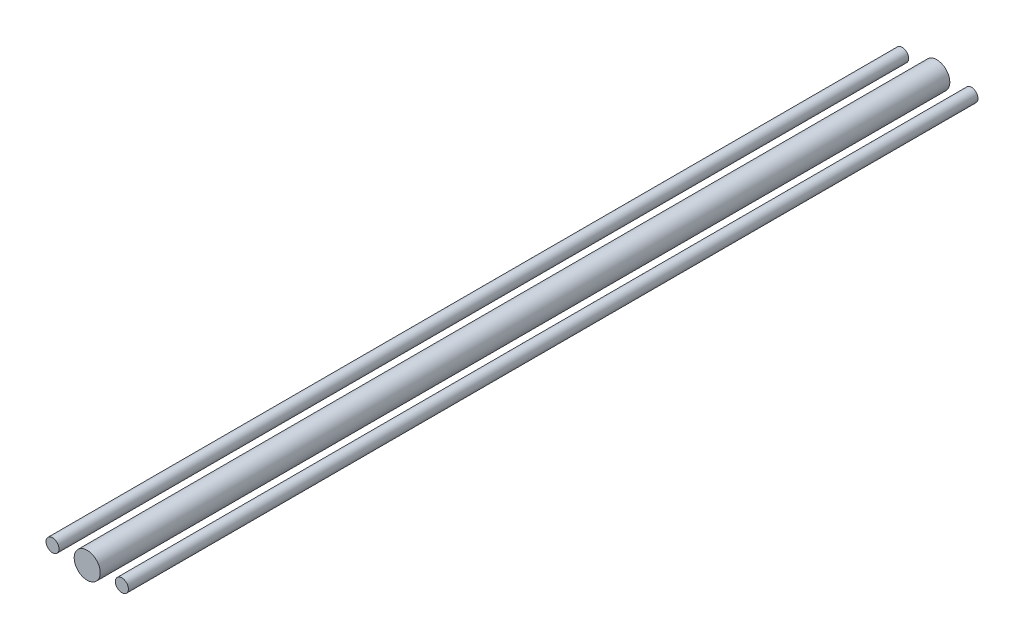
from build123d import *

# Parameters (mm, degrees)
SKETCH_1_R               = 15
EXTRUDE_1_DEPTH          = 1000
SKETCH_6_R               = 7.5
EXTRUDE_2_DEPTH          = 1000
EXTRUDE_2_2_DEPTH        = 1000
CUT_EXTRUDE_1_DEPTH      = 1006.547725945
CUT_EXTRUDE_1_DEPTH_BACK = 1006.547725945
SKETCH_7_W               = 43.373576948
SKETCH_7_H               = 87.109491317


with BuildPart() as part:
    # 草图1 → 凸台-拉伸1 (new body)
    with BuildSketch(Plane.XY):
        Circle(SKETCH_1_R)
    extrude(amount=EXTRUDE_1_DEPTH)


with BuildPart() as body_2:
    # 草图6 → 凸台-拉伸2 (new body)
    with BuildSketch(Plane(origin=(0, 0, 0), x_dir=(-1, 0, 0), z_dir=(0, 0, -1))):
        with Locations((-40, 0)):
            Circle(SKETCH_6_R)
    extrude(amount=-EXTRUDE_2_DEPTH)


with BuildPart() as body_3:
    # 草图6 → Extrude 2 2 (new body)
    with BuildSketch(Plane(origin=(0, 0, 0), x_dir=(-1, 0, 0), z_dir=(0, 0, -1))):
        with Locations((40, 0)):
            Circle(SKETCH_6_R)
    extrude(amount=-EXTRUDE_2_2_DEPTH)


with BuildPart() as cut_extrude_1_tool:
    # 草图7 → 切除-拉伸1 (new, two sides: drawn at the far end of the back side and taken through both)
    with BuildSketch(Plane.ZY.offset(56.908951495).offset(-CUT_EXTRUDE_1_DEPTH_BACK)):
        with Locations((-1.686788474, -10.270563655)):
            Rectangle(SKETCH_7_W, SKETCH_7_H)
    extrude(amount=CUT_EXTRUDE_1_DEPTH + CUT_EXTRUDE_1_DEPTH_BACK)


with BuildPart() as part_1:
    add(part.part)

    # 切除-拉伸1: cut by cut_extrude_1_tool
    add(cut_extrude_1_tool.part, mode=Mode.SUBTRACT)


with BuildPart() as body_2_1:
    add(body_2.part)

    # 切除-拉伸1: cut by cut_extrude_1_tool
    add(cut_extrude_1_tool.part, mode=Mode.SUBTRACT)


with BuildPart() as body_3_1:
    add(body_3.part)

    # 切除-拉伸1: cut by cut_extrude_1_tool
    add(cut_extrude_1_tool.part, mode=Mode.SUBTRACT)


solid = Compound([part_1.part, body_2_1.part, body_3_1.part])
